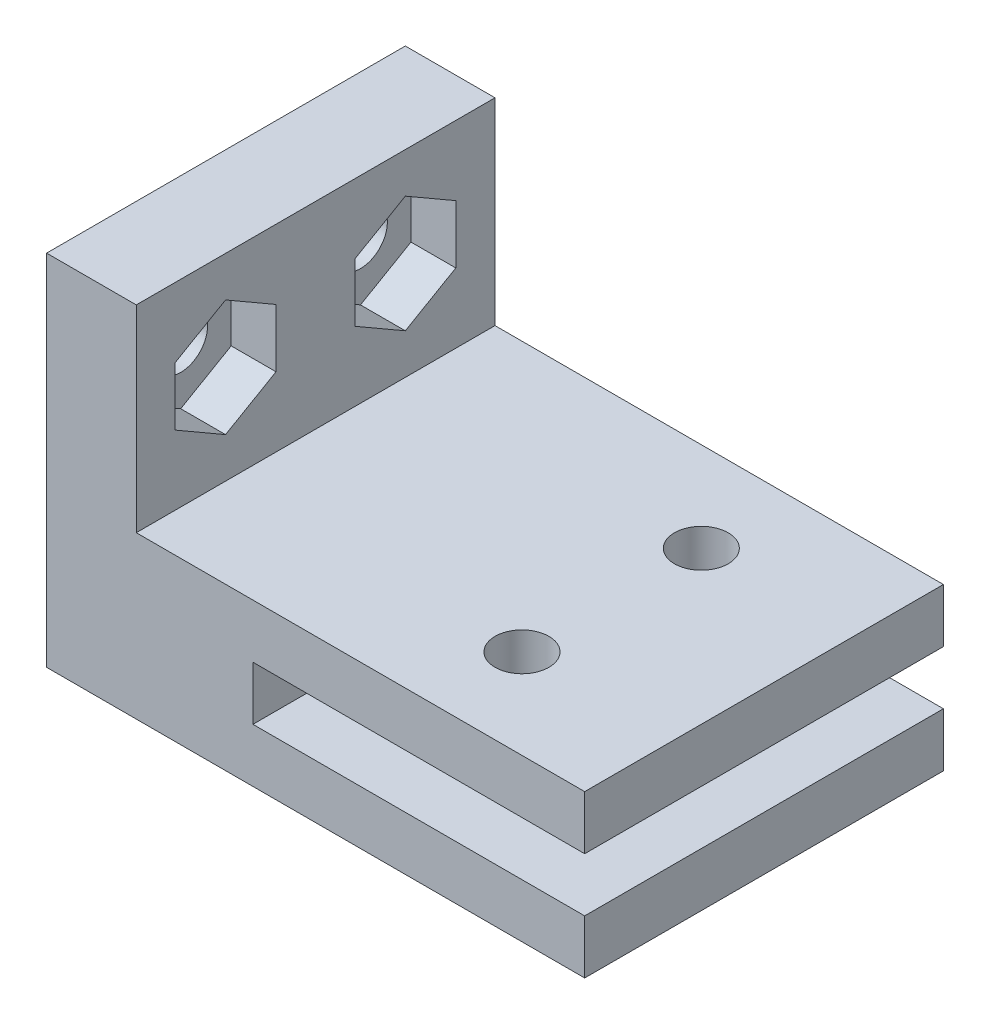
from build123d import *

# Parameters (mm, degrees)
SKETCH2_W           = 40
SKETCH2_H           = 20
BOSS_EXTRUDE2_DEPTH = 20
SKETCH3_W           = 20
SKETCH3_H           = 20
CUT_EXTRUDE1_DEPTH  = 10
SKETCH4_W           = 18.496290815
SKETCH4_H           = 3
CUT_EXTRUDE2_DEPTH  = 31
SKETCH5_R           = 1.5
CUT_EXTRUDE3_DEPTH  = 34.541019662
SKETCH8_R           = 1.5
CUT_EXTRUDE4_DEPTH  = 2.5
CUT_EXTRUDE6_DEPTH  = 31.347981811


with BuildPart() as part:
    # Sketch2 → Boss-Extrude2 (new body)
    with BuildSketch(Plane.XY):
        Rectangle(SKETCH2_W, SKETCH2_H)
    extrude(amount=BOSS_EXTRUDE2_DEPTH)

    # Sketch3 → Cut-Extrude1 (cut)
    with BuildSketch(Plane.ZY.offset(20)):
        with Locations((10, 0)):
            Rectangle(SKETCH3_W, SKETCH3_H)
    extrude(amount=-CUT_EXTRUDE1_DEPTH, mode=Mode.SUBTRACT)

    # Sketch4 → Cut-Extrude2 (cut, through all)
    with BuildSketch(Plane.XY.offset(20)):
        Polygon((-5, -1), (20, -1), (20, 0), (20, 10), (-5, 10), align=None)
        with Locations((10.751854593, -5.5)):
            Rectangle(SKETCH4_W, SKETCH4_H)
    extrude(amount=-CUT_EXTRUDE2_DEPTH, mode=Mode.SUBTRACT)

    # Sketch5 → Cut-Extrude3 (cut, through all)
    with BuildSketch(Plane(origin=(-5, 0, 0), x_dir=(0, 0, -1), z_dir=(1, 0, 0))):
        with Locations((-15.023649692, 4.5)):
            Circle(SKETCH5_R)
        with Locations((-5, 4.5)):
            Circle(SKETCH5_R)
    extrude(amount=-CUT_EXTRUDE3_DEPTH, mode=Mode.SUBTRACT)

    # Sketch8 → Cut-Extrude4 (cut)
    # profile 1 of 2: a face of its own
    with BuildSketch(Plane(origin=(-5, 0, 0), x_dir=(0, 0, -1), z_dir=(1, 0, 0))):
        Polygon((-12.208649692, 2.874758992), (-12.208649692, 6.125241008), (-15.023649692, 7.750482016), (-17.838649692, 6.125241008), (-17.838649692, 2.874758992), (-15.023649692, 1.249517984), align=None)
        with Locations((-15.023649692, 4.5)):
            Circle(SKETCH8_R, mode=Mode.SUBTRACT)
    # profile 2 of 2: a face of its own
    with BuildSketch(Plane(origin=(-5, 0, 0), x_dir=(0, 0, -1), z_dir=(1, 0, 0))):
        Polygon((-2.185, 2.874758992), (-2.185, 6.125241008), (-5, 7.750482016), (-7.815, 6.125241008), (-7.815, 2.874758992), (-5, 1.249517984), align=None)
        with Locations((-5, 4.5)):
            Circle(SKETCH8_R, mode=Mode.SUBTRACT)
    extrude(amount=-CUT_EXTRUDE4_DEPTH, mode=Mode.SUBTRACT)

    # Sketch9 → Cut-Extrude6 (cut, through all)
    with BuildSketch(Plane(origin=(0, -1, 0), x_dir=(1, 0, 0), z_dir=(0, 1, 0))):
        with BuildLine():
            ThreePointArc((11.503709185, -3.5), (10.003709185, -5), (11.503709185, -6.5))
            Line((11.503709185, -6.5), (11.503709185, -3.5))
        make_face()
        with BuildLine():
            Line((11.503709185, -3.5), (11.503709185, -6.5))
            ThreePointArc((11.503709185, -6.5), (12.564369357, -6.060660172), (13.003709185, -5))
            ThreePointArc((13.003709185, -5), (12.564369357, -3.939339828), (11.503709185, -3.5))
        make_face()
        with BuildLine():
            ThreePointArc((11.503709185, -13.5), (10.003709185, -15), (11.503709185, -16.5))
            Line((11.503709185, -16.5), (11.503709185, -13.5))
        make_face()
        with BuildLine():
            Line((11.503709185, -13.5), (11.503709185, -16.5))
            ThreePointArc((11.503709185, -16.5), (12.564369357, -16.060660172), (13.003709185, -15))
            ThreePointArc((13.003709185, -15), (12.564369357, -13.939339828), (11.503709185, -13.5))
        make_face()
    extrude(amount=-CUT_EXTRUDE6_DEPTH, mode=Mode.SUBTRACT)


solid = part.part
